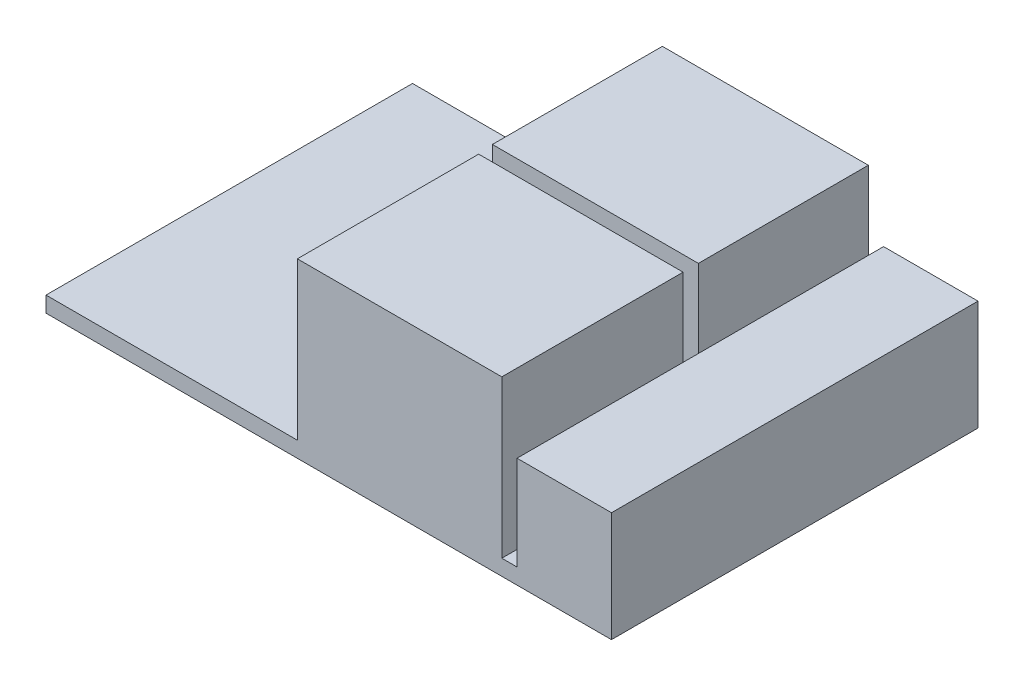
from build123d import *

# Parameters (mm, degrees)
SKETCH_1_W      = 54
SKETCH_1_H      = 35
EXTRUDE_1_DEPTH = 1.5
SKETCH_2_W      = 9.016092248
SKETCH_2_H      = 35
SKETCH_2_W_2    = 19.66831863
SKETCH_2_H_2    = 16.230096049
SKETCH_2_W_3    = 19.52262738
SKETCH_2_H_3    = 17.31299146
EXTRUDE_2_DEPTH = 9
SKETCH_3_W      = 19.66831863
SKETCH_3_H      = 16.230096049
SKETCH_3_W_2    = 19.52262738
SKETCH_3_H_2    = 17.31299146
EXTRUDE_3_DEPTH = 6


with BuildPart() as part:
    # 草图1 → 凸台-拉伸1 (new body)
    with BuildSketch(Plane(origin=(0, 0, 0), x_dir=(1, 0, 0), z_dir=(0, 1, 0))):
        with Locations((27, 119.607926306)):
            Rectangle(SKETCH_1_W, SKETCH_1_H)
    extrude(amount=EXTRUDE_1_DEPTH)

    # 草图2 → 凸台-拉伸2 (add)
    with BuildSketch(Plane(origin=(0, 1.5, 0), x_dir=(1, 0, 0), z_dir=(0, 1, 0))):
        with Locations((49.491953876, 119.607926306)):
            Rectangle(SKETCH_2_W, SKETCH_2_H)
        with Locations((33.692835946, 128.992878281)):
            Rectangle(SKETCH_2_W_2, SKETCH_2_H_2)
        with Locations((33.765681571, 110.764422036)):
            Rectangle(SKETCH_2_W_3, SKETCH_2_H_3)
    extrude(amount=EXTRUDE_2_DEPTH)

    # 草图3 → 凸台-拉伸3 (add)
    with BuildSketch(Plane(origin=(0, 10.5, 0), x_dir=(1, 0, 0), z_dir=(0, 1, 0))):
        with Locations((33.692835946, 128.992878281)):
            Rectangle(SKETCH_3_W, SKETCH_3_H)
        with Locations((33.765681571, 110.764422036)):
            Rectangle(SKETCH_3_W_2, SKETCH_3_H_2)
    extrude(amount=EXTRUDE_3_DEPTH)


solid = part.part
